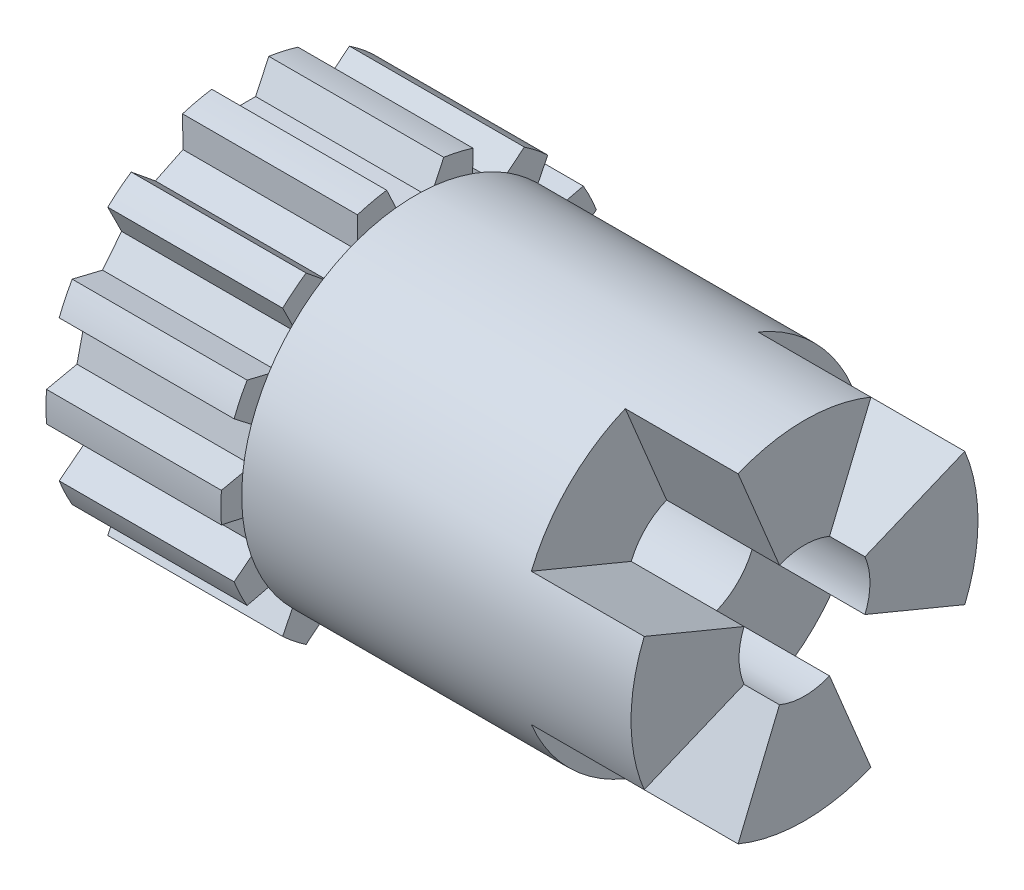
from build123d import *
from build123d.topology import SkipClean

# Parameters (mm, degrees)
SKETCH4_R           = 4.5339
SKETCH4_R_2         = 4.37515
CUT_EXTRUDE2_DEPTH  = 4.064
CUT_EXTRUDE1_DEPTH  = 4.064
CIRPATTERN1_COUNT   = 14
SKETCH6_R           = 1.5875
CUT_EXTRUDE3_DEPTH  = 12.02520933
CUT_EXTRUDE4_DEPTH  = 1.016
SKETCH9_R           = 6.985
CUT_EXTRUDE5_DEPTH  = 1.0414
SKETCH10_R          = 6.985
CUT_EXTRUDE6_DEPTH  = 6.1468
SKETCH12_R          = 1.5875
SKETCH12_R_2        = 1.4732
BOSS_EXTRUDE1_DEPTH = 3.937
BOSS_EXTRUDE2_START = 6.223
SKETCH13_R          = 3.90525
SKETCH13_R_2        = 1.4732
BOSS_EXTRUDE2_DEPTH = 6.223
BOSS_EXTRUDE3_START = 2.54
BOSS_EXTRUDE3_DEPTH = 2.54
CIRPATTERN4_COUNT   = 4


with BuildPart() as part:
    # Sketch1 → Revolve1 (revolve)
    with BuildSketch(Plane.XY, mode=Mode.PRIVATE) as revolve1_sk:
        with BuildLine():
            Line((-5.5626, 1.5875), (5.5626, 1.5875))
            Line((5.5626, 1.5875), (5.5626, 6.731))
            Line((5.5626, 6.731), (5.0419, 6.731))
            ThreePointArc((5.0419, 6.731), (4.654552953, 5.958878742), (4.5212, 5.1054))
            Line((4.5212, 5.1054), (4.5212, 4.5339))
            Line((4.5212, 4.5339), (0.4572, 4.5339))
            Line((0.4572, 4.5339), (0.4572, 5.6769))
            Line((0.4572, 5.6769), (-0.5969, 6.731))
            Line((-0.5969, 6.731), (-5.5626, 6.731))
            Line((-5.5626, 6.731), (-5.5626, 1.5875))
        make_face()
    revolve(revolve1_sk.sketch.rotate(Axis((-5.5626, 0, 0), (1, 0, 0)), 90), axis=Axis((-5.5626, 0, 0), (1, 0, 0)))

    # Sketch4 → Cut-Extrude2 (cut)
    with BuildSketch(Plane(origin=(0.4572, 0, 0), x_dir=(0, 0, -1), z_dir=(1, 0, 0))):
        Circle(SKETCH4_R)
        Circle(SKETCH4_R_2, mode=Mode.SUBTRACT)
    extrude(amount=CUT_EXTRUDE2_DEPTH, mode=Mode.SUBTRACT)

    # Sketch3 → Cut-Extrude1 (cut)
    with BuildSketch(Plane(origin=(0.4572, 0, 0), x_dir=(0, 0, -1), z_dir=(1, 0, 0))):
        with BuildLine():
            Line((-0.641613493, 4.327848154), (-0.345249615, 3.692293767))
            Line((-0.345249615, 3.692293767), (0.345249615, 3.692293767))
            Line((0.345249615, 3.692293767), (0.641613493, 4.327848154))
            ThreePointArc((0.641613493, 4.327848154), (0, 4.37515), (-0.641613493, 4.327848154))
        make_face()
    cut_extrude1 = extrude(amount=CUT_EXTRUDE1_DEPTH, mode=Mode.SUBTRACT)

    # CirPattern1: Cut-Extrude1 ×14 about axis
    cirpattern1_axis = Axis((0, 0, 0), (1, 0, 0))
    for i in range(1, CIRPATTERN1_COUNT):
        add(cut_extrude1.rotate(cirpattern1_axis, i * 360 / CIRPATTERN1_COUNT), mode=Mode.SUBTRACT)

    # Sketch6 → Cut-Extrude3 (cut, through all)
    with BuildSketch(Plane(origin=(0, 0, 0), x_dir=(1, 0, 0), z_dir=(0, 1, 0))):
        with Locations(Location((-2.5527, 0, 0), (0, 0, 90))):
            Circle(SKETCH6_R)
    extrude(amount=CUT_EXTRUDE3_DEPTH, mode=Mode.SUBTRACT)

    # Sketch9 → Cut-Extrude5 (cut)
    with BuildSketch(Plane(origin=(5.5626, 0, 0), x_dir=(0, 0, -1), z_dir=(1, 0, 0))):
        Circle(SKETCH9_R)
    extrude(amount=-CUT_EXTRUDE5_DEPTH, mode=Mode.SUBTRACT)


with BuildPart() as body_2:
    # Sketch7 → Revolve2 (revolve)
    with BuildSketch(Plane.XY, mode=Mode.PRIVATE) as revolve2_sk:
        Polygon((-3.7211, 6.731), (-2.5527, 6.731), (-2.5527, 1.9685), (-3.7211, 1.9685), (-3.9751, 2.2225), (-3.9751, 6.477), align=None)
    revolve(revolve2_sk.sketch.rotate(Axis((-2.5527, 1.9685, 0), (0, 1, 0)), 270), axis=Axis((-2.5527, 1.9685, 0), (0, 1, 0)))

    # Sketch8 → Cut-Extrude4 (cut)
    with BuildSketch(Plane(origin=(0, 6.731, 0), x_dir=(1, 0, 0), z_dir=(0, 1, 0))):
        Polygon((-2.5527, 0.821223023), (-3.2639, 0.410611511), (-3.2639, -0.410611511), (-2.5527, -0.821223023), (-1.8415, -0.410611511), (-1.8415, 0.410611511), align=None)
    extrude(amount=-CUT_EXTRUDE4_DEPTH, mode=Mode.SUBTRACT)


with BuildPart() as cut_extrude6_tool:
    # Sketch10 → Cut-Extrude6 (new body)
    with BuildSketch(Plane.ZY.offset(5.5626)):
        Circle(SKETCH10_R)
    extrude(amount=-CUT_EXTRUDE6_DEPTH)


with BuildPart() as part_1:
    add(part.part)

    # Cut-Extrude6: cut by cut_extrude6_tool
    add(cut_extrude6_tool.part, mode=Mode.SUBTRACT)

    # Sketch12 → Boss-Extrude1 (add)
    with BuildSketch(Plane(origin=(4.5212, 0, 0), x_dir=(0, 0, -1), z_dir=(1, 0, 0))):
        Circle(SKETCH12_R)
        Circle(SKETCH12_R_2, mode=Mode.SUBTRACT)
    extrude(amount=-BOSS_EXTRUDE1_DEPTH)

    # Sketch13 → Boss-Extrude2 (add)
    with BuildSketch(Plane(origin=(4.5212, 0, 0), x_dir=(0, 0, -1), z_dir=(1, 0, 0)).offset(BOSS_EXTRUDE2_START)):
        with Locations(Location((0, 0, 0), (0, 0, 186.486751227))):
            Circle(SKETCH13_R)
        Circle(SKETCH13_R_2, mode=Mode.SUBTRACT)
    extrude(amount=-BOSS_EXTRUDE2_DEPTH)

    # Sketch14 → Boss-Extrude3 (add)
    with SkipClean():  # the faces are left unmerged after this step: merging them gives an invalid solid
        with BuildSketch(Plane(origin=(10.7442, 0, 0), x_dir=(0, 0, -1), z_dir=(1, 0, 0)).offset(BOSS_EXTRUDE3_START)):
            with BuildLine():
                Line((1.361059327, -0.563769233), (3.607980544, -1.494474474))
                ThreePointArc((3.607980544, -1.494474474), (3.90525, 0), (3.607980544, 1.494474474))
                Line((3.607980544, 1.494474474), (1.361059327, 0.563769233))
                ThreePointArc((1.361059327, 0.563769233), (1.4732, 0), (1.361059327, -0.563769233))
            make_face()
        boss_extrude3 = extrude(amount=-BOSS_EXTRUDE3_DEPTH)

    # CirPattern4: Boss-Extrude3 ×4 about axis
    with SkipClean():  # the faces are left unmerged after this step: merging them gives an invalid solid
        cirpattern4_axis = Axis((-3.905928061, 0, 0), (1, 0, 0))
        for i in range(1, CIRPATTERN4_COUNT):
            add(boss_extrude3.rotate(cirpattern4_axis, i * 360 / CIRPATTERN4_COUNT))


with BuildPart() as body_2_1:
    add(body_2.part)

    # Cut-Extrude6: cut by cut_extrude6_tool
    add(cut_extrude6_tool.part, mode=Mode.SUBTRACT)


solid = part_1.part
